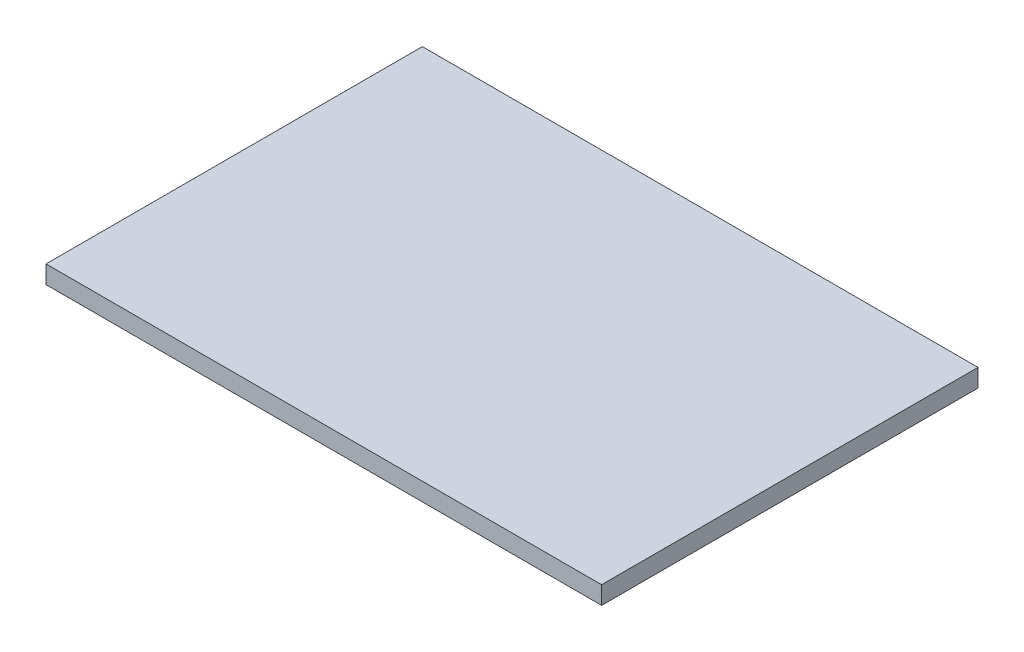
from build123d import *

# Parameters (mm, degrees)
SKETCH1_W           = 155
SKETCH1_H           = 105
BOSS_EXTRUDE1_DEPTH = 5


with BuildPart() as part:
    # Sketch1 → Boss-Extrude1 (new body)
    with BuildSketch(Plane(origin=(0, 0, 0), x_dir=(1, 0, 0), z_dir=(0, 1, 0))):
        with Locations((77.5, 52.5)):
            Rectangle(SKETCH1_W, SKETCH1_H)
    extrude(amount=BOSS_EXTRUDE1_DEPTH)


solid = part.part
